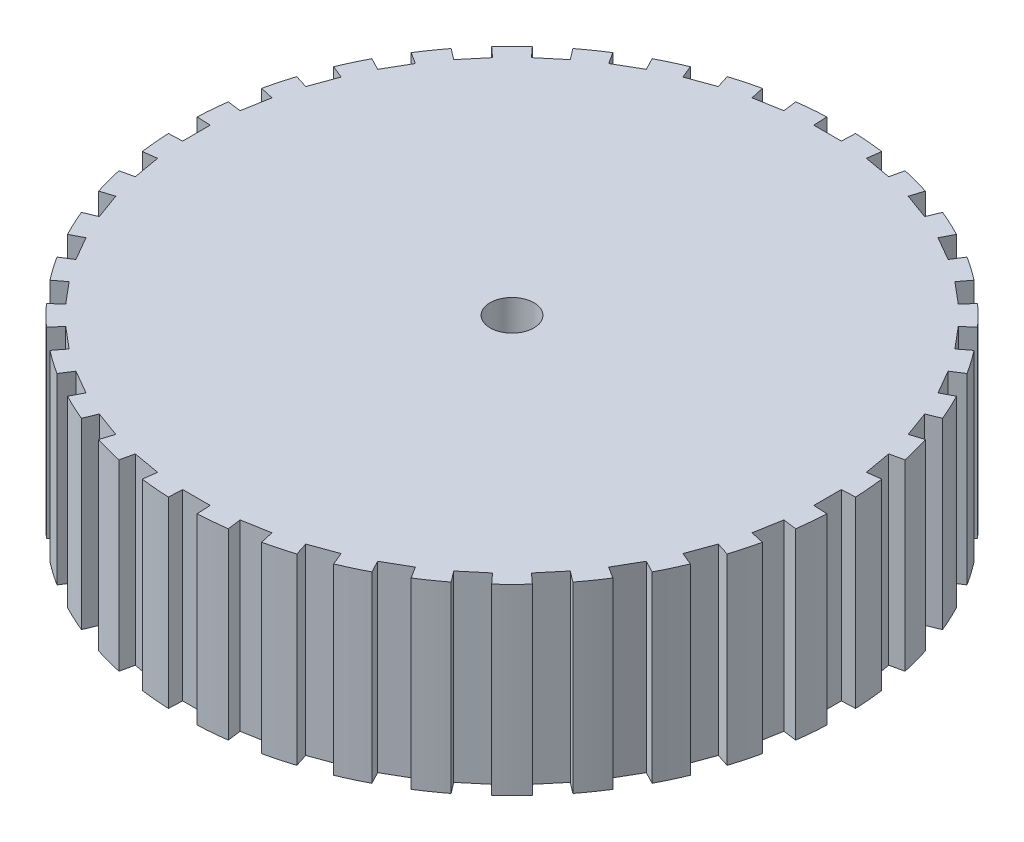
from build123d import *

# Parameters (mm, degrees)
BOSS_EXTRUDE1_DEPTH = 25
CIRPATTERN1_COUNT   = 36
SKETCH2_R           = 2.99
CUT_EXTRUDE1_DEPTH  = 69.317598491


with BuildPart() as part:
    # Sketch1 → Boss-Extrude1 (new body)
    with BuildSketch(Plane(origin=(0, 0, 0), x_dir=(1, 0, 0), z_dir=(0, 1, 0))):
        with BuildLine():
            Line((43.088980321, -1.88130551), (43.088980321, 1.88130551))
            Line((43.088980321, 1.88130551), (44.957169971, 1.962872431))
            ThreePointArc((44.957169971, 1.962872431), (44.903651546, 2.943140815), (44.828761414, 3.922008424))
            Line((44.828761414, 3.922008424), (0, 0))
            Line((0, 0), (44.828761414, -3.922008424))
            ThreePointArc((44.828761414, -3.922008424), (44.903651546, -2.943140815), (44.957169971, -1.962872431))
            Line((44.957169971, -1.962872431), (43.088980321, -1.88130551))
        make_face()
    boss_extrude1 = extrude(amount=BOSS_EXTRUDE1_DEPTH)

    # CirPattern1: Boss-Extrude1 ×36 about axis
    cirpattern1_axis = Axis((0, 0, 0), (0, 1, 0))
    for i in range(1, CIRPATTERN1_COUNT):
        add(boss_extrude1.rotate(cirpattern1_axis, i * 360 / CIRPATTERN1_COUNT))

    # Sketch2 → Cut-Extrude1 (cut, through all)
    with BuildSketch(Plane(origin=(0, 25, 0), x_dir=(1, 0, 0), z_dir=(0, 1, 0))):
        with Locations(Location((0, 0, 0), (0, 0, 270))):
            Circle(SKETCH2_R)
    extrude(amount=-CUT_EXTRUDE1_DEPTH, mode=Mode.SUBTRACT)


solid = part.part
